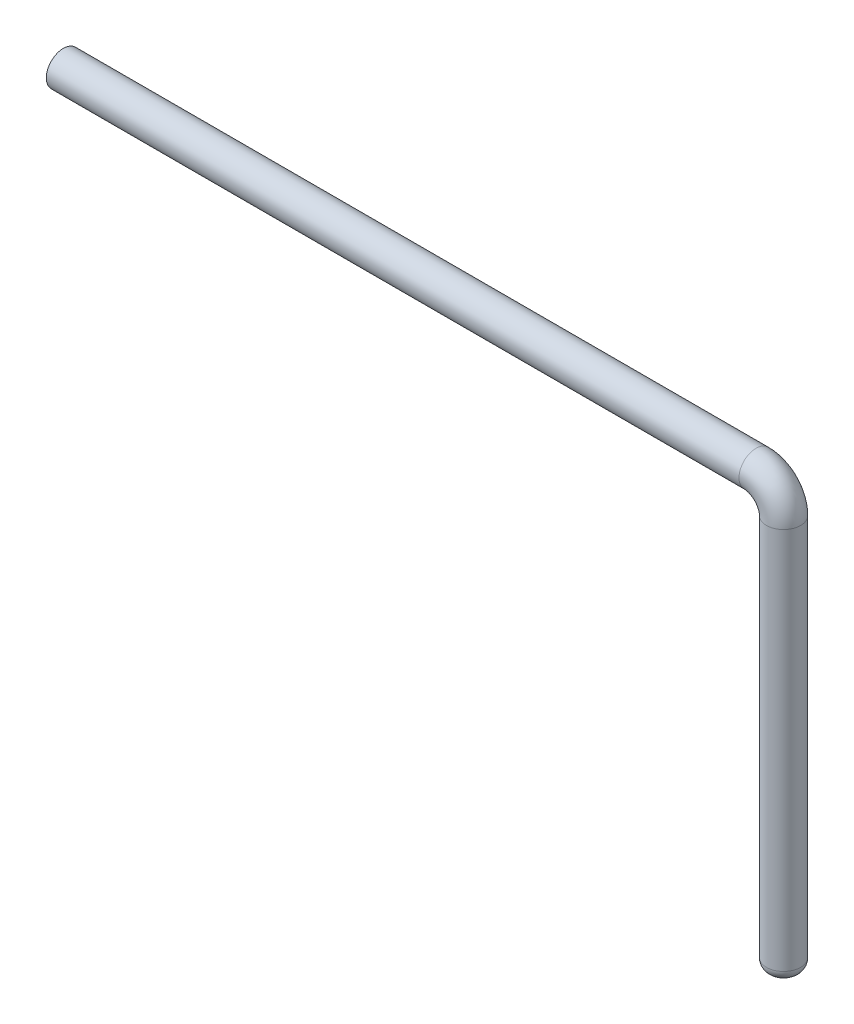
from build123d import *

# Parameters (mm, degrees)
SWEEP_1_PROFILE_R = 0.31
FILLET_1_R        = 0.2


with BuildPart() as part:
    # 扫描1: sweep along a path in 草图1
    with BuildLine(Plane.XY) as sweep_1_path:
        Line((51.422857143, 34.064761905), (64.002857143, 34.064761905))
        ThreePointArc((64.002857143, 34.064761905), (64.356410533, 33.918315295), (64.502857143, 33.564761905))
        Line((64.502857143, 33.564761905), (64.502857143, 26.414761905))
    # 扫描1 profile (on start of the path) → 扫描1 (sweep)
    with BuildSketch(Plane(origin=(51.422857143, 34.064761905, 0), x_dir=(0, 0, 1), z_dir=(1, 0, 0))):
        Circle(SWEEP_1_PROFILE_R)
    sweep(path=sweep_1_path.line)

    # 圆角1
    fillet_1_edges = [part.edges().sort_by_distance(p)[0] for p in [
        (64.502857143, 26.414761905, -0.31),
    ]]
    fillet(fillet_1_edges, radius=FILLET_1_R)


solid = part.part
